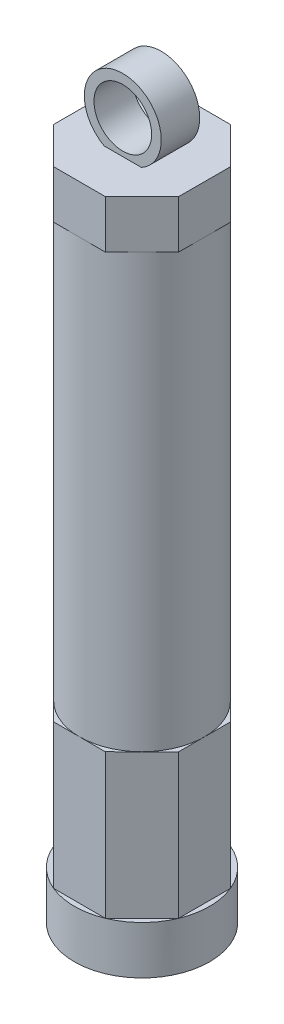
from build123d import *

# Parameters (mm, degrees)
SKETCH1_R           = 6.5
BOSS_EXTRUDE1_DEPTH = 45
BOSS_EXTRUDE2_DEPTH = 5
BOSS_EXTRUDE3_DEPTH = 15
SKETCH4_R           = 7.035549302
BOSS_EXTRUDE4_DEPTH = 5
SKETCH5_R           = 3
BOSS_EXTRUDE5_DEPTH = 2


with BuildPart() as part:
    # Sketch1 → Boss-Extrude1 (new body)
    with BuildSketch(Plane(origin=(0, 0, 0), x_dir=(1, 0, 0), z_dir=(0, 1, 0))):
        with Locations(Location((0, 0, 0), (0, 0, 90))):
            Circle(SKETCH1_R)
    extrude(amount=BOSS_EXTRUDE1_DEPTH)

    # Sketch2 → Boss-Extrude2 (add)
    with BuildSketch(Plane(origin=(0, 45, 0), x_dir=(1, 0, 0), z_dir=(0, 1, 0))):
        Polygon((-6.503321941, -2.684354246), (-2.700417954, -6.496668135), (2.684354246, -6.503321941), (6.496668135, -2.700417954), (6.503321941, 2.684354246), (2.700417954, 6.496668135), (-2.684354246, 6.503321941), (-6.496668135, 2.700417954), align=None)
    extrude(amount=BOSS_EXTRUDE2_DEPTH)

    # Sketch3 → Boss-Extrude3 (add)
    with BuildSketch(Plane.XZ):
        Polygon((-2.700417954, 6.496668135), (-6.503321941, 2.684354246), (-6.496668135, -2.700417954), (-2.684354246, -6.503321941), (2.700417954, -6.496668135), (6.503321941, -2.684354246), (6.496668135, 2.700417954), (2.684354246, 6.503321941), align=None)
    extrude(amount=BOSS_EXTRUDE3_DEPTH)

    # Sketch4 → Boss-Extrude4 (add)
    with BuildSketch(Plane.XZ.offset(15)):
        with Locations(Location((0, 0, 0), (0, 0, 67.570798689))):
            Circle(SKETCH4_R)
    extrude(amount=BOSS_EXTRUDE4_DEPTH)

    # Sketch5 → Boss-Extrude5 (add, symmetric)
    with BuildSketch(Plane.XY):
        with BuildLine():
            Line((1.936491673, 50), (-1.936491673, 50))
            ThreePointArc((-1.936491673, 50), (0, 57.5), (1.936491673, 50))
        make_face()
        with Locations((0, 53.5)):
            Circle(SKETCH5_R, mode=Mode.SUBTRACT)
    extrude(amount=BOSS_EXTRUDE5_DEPTH, both=True)


solid = part.part
